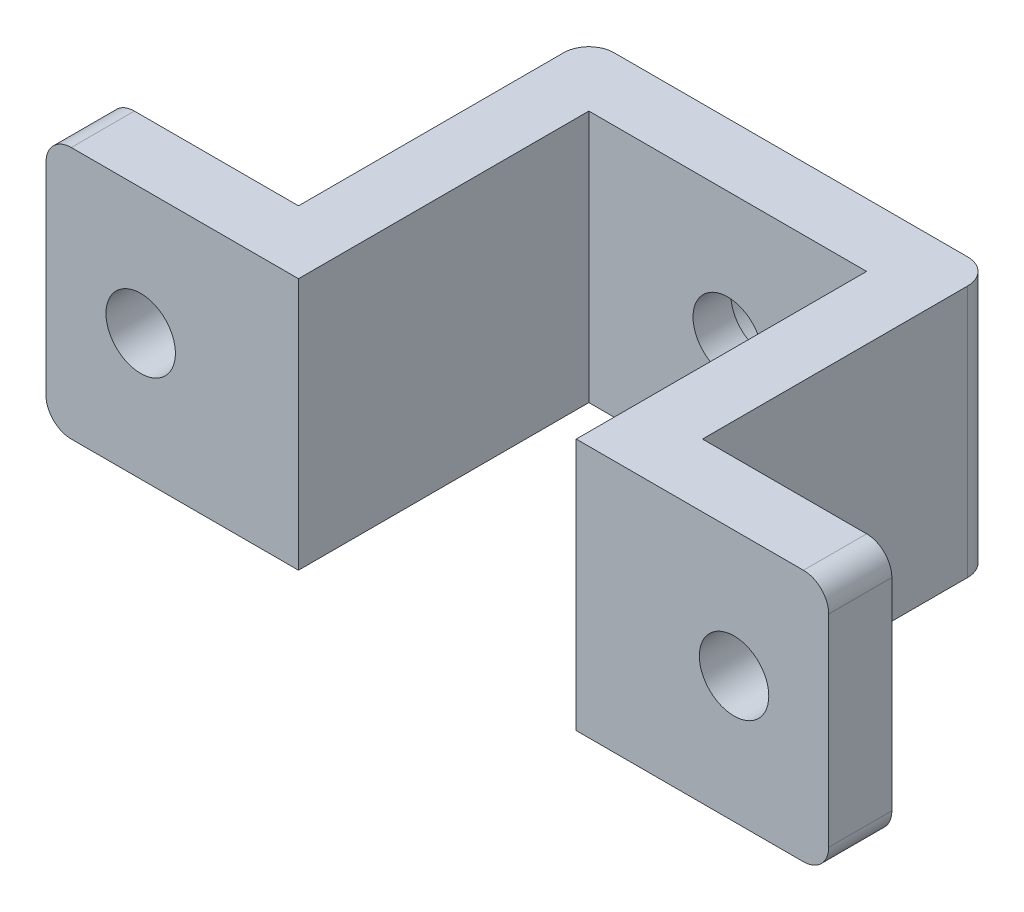
from build123d import *

# Parameters (mm, degrees)
EXTRUDE_1_DEPTH     = 20
SKETCH_2_R          = 2.75
CUT_EXTRUDE_1_DEPTH = 40.770397535
SKETCH_3_W          = 5
SKETCH_3_H          = 20
EXTRUDE_2_DEPTH     = 15
SKETCH_4_R          = 2.75
CUT_EXTRUDE_2_DEPTH = 41.757009157
FILLET_1_R          = 2
SKETCH_5_R          = 4
CUT_EXTRUDE_3_DEPTH = 2


with BuildPart() as part:
    # 草图1 → 凸台-拉伸1 (new body)
    with BuildSketch(Plane(origin=(0, 0, 0), x_dir=(1, 0, 0), z_dir=(0, 1, 0))):
        Polygon((-12.057971014, 6.222222222), (19.942028986, 6.222222222), (19.942028986, -21.777777778), (14.942028986, -21.777777778), (14.942028986, -16.777777778), (14.942028986, 1.222222222), (-7.057971014, 1.222222222), (-7.057971014, -16.777777778), (-7.057971014, -21.777777778), (-12.057971014, -21.777777778), align=None)
    extrude(amount=EXTRUDE_1_DEPTH)

    # 草图2 → 切除-拉伸1 (cut, through all)
    with BuildSketch(Plane(origin=(0, 0, -6.222222222), x_dir=(-1, 0, 0), z_dir=(0, 0, -1))):
        with Locations((-3.942028986, 10)):
            Circle(SKETCH_2_R)
    extrude(amount=-CUT_EXTRUDE_1_DEPTH, mode=Mode.SUBTRACT)

    # 草图3 → 凸台-拉伸2 (add)
    with BuildSketch(Plane.ZY.offset(12.057971014)):
        with Locations((19.277777778, 10)):
            Rectangle(SKETCH_3_W, SKETCH_3_H)
    extrude_2 = extrude(amount=EXTRUDE_2_DEPTH)

    # 草图4 → 切除-拉伸2 (cut, through all)
    with BuildSketch(Plane(origin=(0, 0, 16.777777778), x_dir=(-1, 0, 0), z_dir=(0, 0, -1))):
        with Locations((19.557971014, 10)):
            Circle(SKETCH_4_R)
    cut_extrude_2 = extrude(amount=-CUT_EXTRUDE_2_DEPTH, mode=Mode.SUBTRACT)

    # 镜向5: 凸台-拉伸2, 切除-拉伸2 across plane
    add(extrude_2.mirror(Plane.ZY.offset(-3.942028986)))
    add(cut_extrude_2.mirror(Plane.ZY.offset(-3.942028986)), mode=Mode.SUBTRACT)

    # 圆角1
    fillet_1_edges = [part.edges().sort_by_distance(p)[0] for p in [
        (-12.057971014, 10, -6.222222222),
        (19.942028986, 10, -6.222222222),
        (-27.057971014, 0, 19.277777778),
        (-27.057971014, 20, 19.277777778),
        (34.942028986, 0, 19.277777778),
        (34.942028986, 20, 19.277777778),
    ]]
    fillet(fillet_1_edges, radius=FILLET_1_R)

    # 草图5 → 切除-拉伸3 (cut)
    with BuildSketch(Plane(origin=(0, 0, -6.222222222), x_dir=(-1, 0, 0), z_dir=(0, 0, -1))):
        with Locations((-3.942028986, 10)):
            Circle(SKETCH_5_R)
    extrude(amount=-CUT_EXTRUDE_3_DEPTH, mode=Mode.SUBTRACT)


solid = part.part
